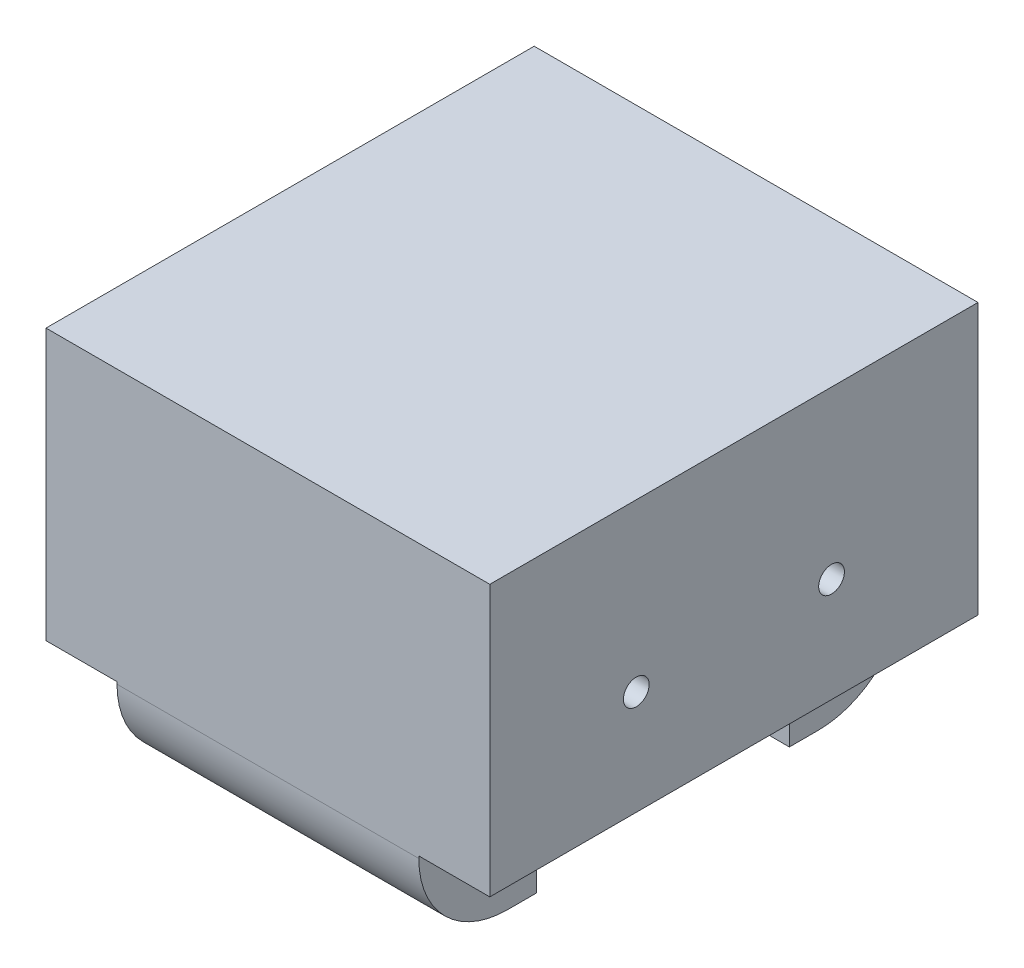
from build123d import *

# Parameters (mm, degrees)
SKETCH1_W           = 50
SKETCH1_H           = 170
BOSS_EXTRUDE1_DEPTH = 55
SKETCH2_W           = 34
SKETCH2_H           = 27
CUT_EXTRUDE1_DEPTH  = 181.416185527
SKETCH3_W           = 10
SKETCH3_H           = 24
SKETCH3_R           = 4.25
SKETCH3_R_2         = 1
CUT_EXTRUDE2_DEPTH  = 186.539753153
SKETCH4_W           = 2
SKETCH4_H           = 24
CUT_EXTRUDE3_DEPTH  = 178.623196683
SKETCH5_W           = 6.25
SKETCH5_H           = 11.25
CUT_EXTRUDE4_DEPTH  = 186.539753153
SKETCH6_W           = 38
SKETCH6_H           = 10
CUT_EXTRUDE5_DEPTH  = 181.416185527
SKETCH8_W           = 13.25
SKETCH8_H           = 2.25
CUT_EXTRUDE7_DEPTH  = 186.539753153
SKETCH9_W           = 34
SKETCH9_H           = 35.25
CUT_EXTRUDE8_DEPTH  = 179.297679458
SKETCH11_W          = 13.25
SKETCH11_H          = 20.25
CUT_EXTRUDE9_DEPTH  = 184.480414486
SKETCH12_W          = 28.5
SKETCH12_H          = 15
BOSS_EXTRUDE2_DEPTH = 8
SKETCH14_W          = 34
SKETCH14_H          = 15
SKETCH14_H_2        = 10.25
BOSS_EXTRUDE3_DEPTH = 13.25
SKETCH16_R          = 4.5
SKETCH16_R_2        = 2.5
CUT_EXTRUDE13_DEPTH = 8
SKETCH17_W          = 16.25
SKETCH17_H          = 18
CUT_EXTRUDE14_DEPTH = 175.384811552
CUT_EXTRUDE15_DEPTH = 175.384811552
SKETCH20_W          = 42
SKETCH20_H          = 6.25
SKETCH20_H_2        = 18
SKETCH20_H_3        = 58.75
CUT_EXTRUDE18_DEPTH = 169.923244404
SKETCH22_R          = 4.5
SKETCH22_R_2        = 1.45
BOSS_EXTRUDE4_DEPTH = 8
SKETCH23_W          = 2
SKETCH23_H          = 10
CUT_EXTRUDE19_DEPTH = 165.352137193
FILLET1_R           = 10
SKETCH24_W          = 55
SKETCH24_H          = 55
CUT_EXTRUDE20_DEPTH = 175.384811552
SKETCH25_W          = 109.643028434
SKETCH25_H          = 82.573484069
CUT_EXTRUDE21_DEPTH = 175.384811552


with BuildPart() as part:
    # Sketch1 → Boss-Extrude1 (new body)
    with BuildSketch(Plane.XY):
        with Locations((0, -85)):
            Rectangle(SKETCH1_W, SKETCH1_H)
    extrude(amount=-BOSS_EXTRUDE1_DEPTH)

    # Sketch2 → Cut-Extrude1 (cut, through all)
    with BuildSketch(Plane.XY):
        with Locations((0, -13.5)):
            Rectangle(SKETCH2_W, SKETCH2_H)
    extrude(amount=-CUT_EXTRUDE1_DEPTH, mode=Mode.SUBTRACT)

    # Sketch3 → Cut-Extrude2 (cut, through all)
    with BuildSketch(Plane(origin=(25, 0, 0), x_dir=(0, 0, -1), z_dir=(1, 0, 0))):
        with Locations((50, -12)):
            Rectangle(SKETCH3_W, SKETCH3_H)
        with Locations((5, -12)):
            Rectangle(SKETCH3_W, SKETCH3_H)
        with Locations(Location((27.5, -12.75, 0), (0, 0, 90))):
            Circle(SKETCH3_R)
        with Locations(Location((35.5, -12.75, 0), (0, 0, 90))):
            Circle(SKETCH3_R_2)
        with Locations(Location((27.5, -4.75, 0), (0, 0, 90))):
            Circle(SKETCH3_R_2)
        with Locations(Location((27.5, -20.75, 0), (0, 0, 90))):
            Circle(SKETCH3_R_2)
        with Locations(Location((19.5, -12.75, 0), (0, 0, 90))):
            Circle(SKETCH3_R_2)
    extrude(amount=-CUT_EXTRUDE2_DEPTH, mode=Mode.SUBTRACT)

    # Sketch4 → Cut-Extrude3 (cut, through all)
    with BuildSketch(Plane.XY.offset(-10)):
        with Locations((-18, -12)):
            Rectangle(SKETCH4_W, SKETCH4_H)
        with Locations((18, -12)):
            Rectangle(SKETCH4_W, SKETCH4_H)
    extrude(amount=-CUT_EXTRUDE3_DEPTH, mode=Mode.SUBTRACT)

    # Sketch5 → Cut-Extrude4 (cut, through all)
    with BuildSketch(Plane(origin=(25, 0, 0), x_dir=(0, 0, -1), z_dir=(1, 0, 0))):
        with BuildLine():
            Line((45, 0), (10, 0))
            Line((10, 0), (10, -12.75))
            Line((10, -12.75), (16.25, -12.75))
            ThreePointArc((16.25, -12.75), (27.5, -1.5), (38.75, -12.75))
            Line((38.75, -12.75), (45, -12.75))
            Line((45, -12.75), (45, 0))
        make_face()
        with Locations((13.125, -18.375)):
            Rectangle(SKETCH5_W, SKETCH5_H)
        with Locations((41.875, -18.375)):
            Rectangle(SKETCH5_W, SKETCH5_H)
    extrude(amount=-CUT_EXTRUDE4_DEPTH, mode=Mode.SUBTRACT)

    # Sketch6 → Cut-Extrude5 (cut, through all)
    with BuildSketch(Plane.XY):
        with Locations((0, -29)):
            Rectangle(SKETCH6_W, SKETCH6_H)
    extrude(amount=-CUT_EXTRUDE5_DEPTH, mode=Mode.SUBTRACT)

    # Sketch8 → Cut-Extrude7 (cut, through all)
    with BuildSketch(Plane(origin=(25, 0, 0), x_dir=(0, 0, -1), z_dir=(1, 0, 0))):
        with BuildLine():
            Line((27.5, -157.5), (27.5, -132.5))
            Line((27.5, -132.5), (13.25, -132.5))
            Line((13.25, -132.5), (13.25, -167.75))
            Line((13.25, -167.75), (17.25, -167.75))
            ThreePointArc((17.25, -167.75), (20.252155493, -160.502155493), (27.5, -157.5))
        make_face()
        with BuildLine():
            Line((41.75, -167.75), (41.75, -132.5))
            Line((41.75, -132.5), (27.5, -132.5))
            Line((27.5, -132.5), (27.5, -157.5))
            ThreePointArc((27.5, -157.5), (34.747844507, -160.502155493), (37.75, -167.75))
            Line((37.75, -167.75), (41.75, -167.75))
        make_face()
        with Locations((48.375, -168.875)):
            Rectangle(SKETCH8_W, SKETCH8_H)
        with Locations((6.625, -168.875)):
            Rectangle(SKETCH8_W, SKETCH8_H)
        with BuildLine():
            Line((17.25, -167.75), (13.25, -167.75))
            Line((13.25, -167.75), (13.25, -170))
            Line((13.25, -170), (17.5, -170))
            ThreePointArc((17.5, -170), (17.31269172, -168.881923142), (17.25, -167.75))
        make_face()
        with BuildLine():
            Line((41.75, -170), (41.75, -167.75))
            Line((41.75, -167.75), (37.75, -167.75))
            ThreePointArc((37.75, -167.75), (37.68730828, -168.881923142), (37.5, -170))
            Line((37.5, -170), (41.75, -170))
        make_face()
        with BuildLine():
            Line((27.5, -167.75), (27.5, -157.5))
            ThreePointArc((27.5, -157.5), (20.252155493, -160.502155493), (17.25, -167.75))
            Line((17.25, -167.75), (27.5, -167.75))
        make_face()
        with BuildLine():
            ThreePointArc((37.75, -167.75), (34.747844507, -160.502155493), (27.5, -157.5))
            Line((27.5, -157.5), (27.5, -167.75))
            Line((27.5, -167.75), (37.75, -167.75))
        make_face()
        with BuildLine():
            Line((27.5, -170), (27.5, -167.75))
            Line((27.5, -167.75), (17.25, -167.75))
            ThreePointArc((17.25, -167.75), (17.31269172, -168.881923142), (17.5, -170))
            Line((17.5, -170), (27.5, -170))
        make_face()
        with BuildLine():
            ThreePointArc((37.5, -170), (37.68730828, -168.881923142), (37.75, -167.75))
            Line((37.75, -167.75), (27.5, -167.75))
            Line((27.5, -167.75), (27.5, -170))
            Line((27.5, -170), (37.5, -170))
        make_face()
    extrude(amount=-CUT_EXTRUDE7_DEPTH, mode=Mode.SUBTRACT)

    # Sketch9 → Cut-Extrude8 (cut, through all)
    with BuildSketch(Plane.XY):
        with Locations((0, -150.125)):
            Rectangle(SKETCH9_W, SKETCH9_H)
    extrude(amount=-CUT_EXTRUDE8_DEPTH, mode=Mode.SUBTRACT)

    # Sketch11 → Cut-Extrude9 (cut, through all)
    with BuildSketch(Plane(origin=(25, 0, 0), x_dir=(0, 0, -1), z_dir=(1, 0, 0))):
        with BuildLine():
            ThreePointArc((17.25, -167.75), (20.252155493, -160.502155493), (27.5, -157.5))
            Line((27.5, -157.5), (27.5, -147.5))
            Line((27.5, -147.5), (13.25, -147.5))
            Line((13.25, -147.5), (13.25, -167.75))
            Line((13.25, -167.75), (17.25, -167.75))
        make_face()
        with BuildLine():
            Line((27.5, -147.5), (27.5, -157.5))
            ThreePointArc((27.5, -157.5), (34.747844507, -160.502155493), (37.75, -167.75))
            Line((37.75, -167.75), (41.75, -167.75))
            Line((41.75, -167.75), (41.75, -147.5))
            Line((41.75, -147.5), (27.5, -147.5))
        make_face()
        with Locations((48.375, -157.625)):
            Rectangle(SKETCH11_W, SKETCH11_H)
        with Locations((6.625, -157.625)):
            Rectangle(SKETCH11_W, SKETCH11_H)
    extrude(amount=-CUT_EXTRUDE9_DEPTH, mode=Mode.SUBTRACT)

    # Sketch12 → Boss-Extrude2 (add)
    with BuildSketch(Plane(origin=(25, 0, 0), x_dir=(0, 0, -1), z_dir=(1, 0, 0))):
        with Locations((27.5, -140)):
            Rectangle(SKETCH12_W, SKETCH12_H)
    boss_extrude2 = extrude(amount=-BOSS_EXTRUDE2_DEPTH)

    # Mirror1: Boss-Extrude2 across plane
    add(boss_extrude2.mirror(Plane(origin=(0, 0, 0), x_dir=(0, 0, 1), z_dir=(1, 0, 0))))

    # Sketch14 → Boss-Extrude3 (add)
    with BuildSketch(Plane.XY):
        with Locations((0, -140)):
            Rectangle(SKETCH14_W, SKETCH14_H)
        with Locations((0, -152.625)):
            Rectangle(SKETCH14_W, SKETCH14_H_2)
    boss_extrude3 = extrude(amount=-BOSS_EXTRUDE3_DEPTH)

    # Mirror2: Boss-Extrude3 across plane
    add(boss_extrude3.mirror(Plane.XY.offset(-27.5)))

    # Sketch16 → Cut-Extrude13 (cut)
    # profile 1 of 3: a face of its own
    with BuildSketch(Plane(origin=(25, 0, 0), x_dir=(0, 0, -1), z_dir=(1, 0, 0))):
        with Locations(Location((16.5, -135.75, 0), (0, 0, 90))):
            Circle(SKETCH16_R)
        with Locations((16.5, -135.75)):
            Circle(SKETCH16_R_2, mode=Mode.SUBTRACT)
    # profile 2 of 3: a face of its own
    with BuildSketch(Plane(origin=(25, 0, 0), x_dir=(0, 0, -1), z_dir=(1, 0, 0))):
        with Locations((16.5, -135.75)):
            Circle(SKETCH16_R_2)
    # profile 3 of 3: a face of its own
    with BuildSketch(Plane(origin=(25, 0, 0), x_dir=(0, 0, -1), z_dir=(1, 0, 0))):
        with Locations(Location((38.5, -135.75, 0), (0, 0, 90))):
            Circle(SKETCH16_R)
    cut_extrude13 = extrude(amount=-CUT_EXTRUDE13_DEPTH, mode=Mode.SUBTRACT)

    # Mirror3: Cut-Extrude13 across plane
    add(cut_extrude13.mirror(Plane(origin=(0, 0, 0), x_dir=(0, 0, 1), z_dir=(1, 0, 0))), mode=Mode.SUBTRACT)

    # Sketch17 → Cut-Extrude14 (cut, through all)
    with BuildSketch(Plane(origin=(25, 0, 0), x_dir=(0, 0, -1), z_dir=(1, 0, 0))):
        with Locations((46.875, -33)):
            Rectangle(SKETCH17_W, SKETCH17_H)
        with Locations((8.125, -33)):
            Rectangle(SKETCH17_W, SKETCH17_H)
    extrude(amount=-CUT_EXTRUDE14_DEPTH, mode=Mode.SUBTRACT)

    # Sketch18 → Cut-Extrude15 (cut, through all)
    with BuildSketch(Plane(origin=(25, 0, 0), x_dir=(0, 0, -1), z_dir=(1, 0, 0))):
        with BuildLine():
            ThreePointArc((0, -58.25), (4.759514806, -46.759514806), (16.25, -42))
            Line((16.25, -42), (0, -42))
            Line((0, -42), (0, -58.25))
        make_face()
        with BuildLine():
            Line((55, -42), (38.75, -42))
            ThreePointArc((38.75, -42), (50.240485194, -46.759514806), (55, -58.25))
            Line((55, -58.25), (55, -42))
        make_face()
    extrude(amount=-CUT_EXTRUDE15_DEPTH, mode=Mode.SUBTRACT)

    # Sketch20 → Cut-Extrude18 (cut, through all)
    with BuildSketch(Plane(origin=(0, 0, -55), x_dir=(-1, 0, 0), z_dir=(0, 0, -1))):
        with Locations((0, -55.125)):
            Rectangle(SKETCH20_W, SKETCH20_H)
        with Locations((0, -43)):
            Rectangle(SKETCH20_W, SKETCH20_H_2)
        with Locations((0, -87.625)):
            Rectangle(SKETCH20_W, SKETCH20_H_3)
    extrude(amount=-CUT_EXTRUDE18_DEPTH, mode=Mode.SUBTRACT)

    # Sketch22 → Boss-Extrude4 (add)
    # profile 1 of 2: a face of its own
    with BuildSketch(Plane.ZY.offset(25)):
        with Locations(Location((-38.5, -135.75, 0), (0, 0, 90))):
            Circle(SKETCH22_R)
        with Locations(Location((-38.5, -135.75, 0), (0, 0, 270))):
            Circle(SKETCH22_R_2, mode=Mode.SUBTRACT)
    # profile 2 of 2: a face of its own
    with BuildSketch(Plane.ZY.offset(25)):
        with Locations(Location((-16.5, -135.75, 0), (0, 0, 90))):
            Circle(SKETCH22_R)
        with Locations(Location((-16.5, -135.75, 0), (0, 0, 270))):
            Circle(SKETCH22_R_2, mode=Mode.SUBTRACT)
    boss_extrude4 = extrude(amount=-BOSS_EXTRUDE4_DEPTH)

    # Mirror4: Boss-Extrude4 across plane
    add(boss_extrude4.mirror(Plane(origin=(0, 0, 0), x_dir=(0, 0, 1), z_dir=(1, 0, 0))))

    # Sketch23 → Cut-Extrude19 (cut, through all)
    with BuildSketch(Plane(origin=(0, 0, -38.75), x_dir=(-1, 0, 0), z_dir=(0, 0, -1))):
        with Locations((-20, -29)):
            Rectangle(SKETCH23_W, SKETCH23_H)
        with Locations((20, -29)):
            Rectangle(SKETCH23_W, SKETCH23_H)
    extrude(amount=-CUT_EXTRUDE19_DEPTH, mode=Mode.SUBTRACT)

    # Fillet1
    fillet1_edges = [part.edges().sort_by_distance(p)[0] for p in [
        (0, -157.75, 0),
        (0, -157.75, -55),
    ]]
    fillet(fillet1_edges, radius=FILLET1_R)

    # Sketch24 → Cut-Extrude20 (cut, through all)
    with BuildSketch(Plane.ZY.offset(25)):
        with Locations((-27.5, -89.5)):
            Rectangle(SKETCH24_W, SKETCH24_H)
    extrude(amount=-CUT_EXTRUDE20_DEPTH, mode=Mode.SUBTRACT)


with BuildPart() as cut_extrude20_piece_1:
    # of the separate pieces the step leaves, piece 1, a body of its own (cut_extrude20_pieces)
    add(part.part.solids().sort_by_distance((17, -147.75, 0))[0])


with BuildPart() as cut_extrude20_piece_2:
    # of the separate pieces the step leaves, piece 2, a body of its own (cut_extrude20_pieces)
    add(part.part.solids().sort_by_distance((25, -58.25, 0))[0])


with BuildPart() as cut_extrude20_piece_3:
    # of the separate pieces the step leaves, piece 3, a body of its own (cut_extrude20_pieces)
    add(part.part.solids().sort_by_distance((-25, -62, 0))[0])


with BuildPart() as cut_extrude21_tool:
    # Sketch25 → Cut-Extrude21 (new, through all)
    with BuildSketch(Plane.ZY.offset(25)):
        with Locations((-25.125575684, -34.55424545)):
            Rectangle(SKETCH25_W, SKETCH25_H)
    extrude(amount=-CUT_EXTRUDE21_DEPTH)


with BuildPart() as cut_extrude20_piece_2_1:
    add(cut_extrude20_piece_2.part)

    # Cut-Extrude21: cut by cut_extrude21_tool
    add(cut_extrude21_tool.part, mode=Mode.SUBTRACT)


with BuildPart() as cut_extrude20_piece_3_1:
    add(cut_extrude20_piece_3.part)

    # Cut-Extrude21: cut by cut_extrude21_tool
    add(cut_extrude21_tool.part, mode=Mode.SUBTRACT)


solid = cut_extrude20_piece_1.part
